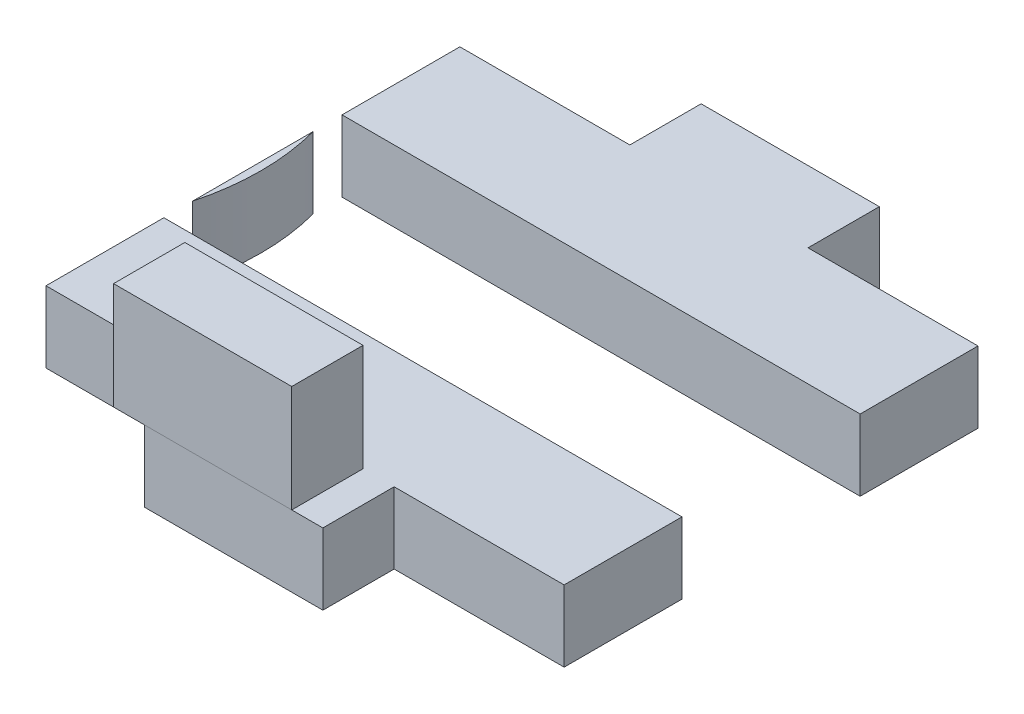
from build123d import *

# Parameters (mm, degrees)
SKETCH1_R           = 2.5
BOSS_EXTRUDE2_DEPTH = 4
SKETCH12_W          = 10
SKETCH12_H          = 4
BOSS_EXTRUDE4_DEPTH = 4
SKETCH14_W          = 10
SKETCH14_H          = 4
BOSS_EXTRUDE5_DEPTH = 4
CUT_EXTRUDE1_DEPTH  = 6
SKETCH11_W          = 10
SKETCH11_H          = 6
BOSS_EXTRUDE3_DEPTH = 4


with BuildPart() as part:
    # Sketch1 → Boss-Extrude2 (new body)
    with BuildSketch(Plane(origin=(0, 0, 0), x_dir=(1, 0, 0), z_dir=(0, 1, 0))):
        Polygon((36.786877756, 11.613831083), (41.786877756, 11.613831083), (41.786877756, -11.613831083), (36.786877756, -11.613831083), (27.518556454, -11.613831083), (12.70818574, -11.613831083), (12.70818574, 11.613831083), (27.518556454, 11.613831083), align=None)
        with Locations(Location((16.5, 0, 0), (0, 0, 270))):
            Circle(SKETCH1_R, mode=Mode.SUBTRACT)
        with Locations(Location((22.5, 0, 0), (0, 0, 270))):
            Circle(SKETCH1_R, mode=Mode.SUBTRACT)
        with Locations(Location((28.5, 0, 0), (0, 0, 270))):
            Circle(SKETCH1_R, mode=Mode.SUBTRACT)
        with Locations(Location((34.5, 0, 0), (0, 0, 270))):
            Circle(SKETCH1_R, mode=Mode.SUBTRACT)
    extrude(amount=BOSS_EXTRUDE2_DEPTH)

    # Sketch12 → Boss-Extrude4 (add)
    with BuildSketch(Plane(origin=(0, 0, -11.613831083), x_dir=(-1, 0, 0), z_dir=(0, 0, -1))):
        with Locations((-27.247531748, 2)):
            Rectangle(SKETCH12_W, SKETCH12_H)
    extrude(amount=BOSS_EXTRUDE4_DEPTH)

    # Sketch14 → Boss-Extrude5 (add)
    with BuildSketch(Plane.XY.offset(11.613831083)):
        with Locations((27.247531748, 2)):
            Rectangle(SKETCH14_W, SKETCH14_H)
    extrude(amount=BOSS_EXTRUDE5_DEPTH)

    # Sketch10 → Cut-Extrude1 (cut)
    with BuildSketch(Plane(origin=(0, 4, 0), x_dir=(1, 0, 0), z_dir=(0, 1, 0))):
        with BuildLine():
            Line((41.812282814, 5), (41.812282814, -5))
            Line((41.812282814, -5), (12.163639885, -5))
            ThreePointArc((12.163639885, -5), (13.151202806, 0), (12.163639885, 5))
            Line((12.163639885, 5), (41.812282814, 5))
        make_face()
    extrude(amount=-CUT_EXTRUDE1_DEPTH, mode=Mode.SUBTRACT)


with BuildPart() as cut_extrude1_piece_1:
    # of the separate pieces the step leaves, piece 1, a body of its own (cut_extrude1_pieces)
    add(part.part.solids().sort_by_distance((41.786877756, 0, -11.613831083))[0])


with BuildPart() as cut_extrude1_piece_2:
    # of the separate pieces the step leaves, piece 2, a body of its own (cut_extrude1_pieces)
    add(part.part.solids().sort_by_distance((41.786877756, 0, 5))[0])


with BuildPart() as cut_extrude1_piece_3:
    # of the separate pieces the step leaves, piece 3, a body of its own (cut_extrude1_pieces)
    add(part.part.solids().sort_by_distance((12.70818574, 4, 3.384693553))[0])


with BuildPart() as body_4:
    # Sketch11 → Boss-Extrude3 (new body)
    with BuildSketch(Plane.XY.offset(11.613831083)):
        with Locations((25.5, 7)):
            Rectangle(SKETCH11_W, SKETCH11_H)
    extrude(amount=BOSS_EXTRUDE3_DEPTH)


solid = Compound([cut_extrude1_piece_1.part, cut_extrude1_piece_2.part, cut_extrude1_piece_3.part, body_4.part])
